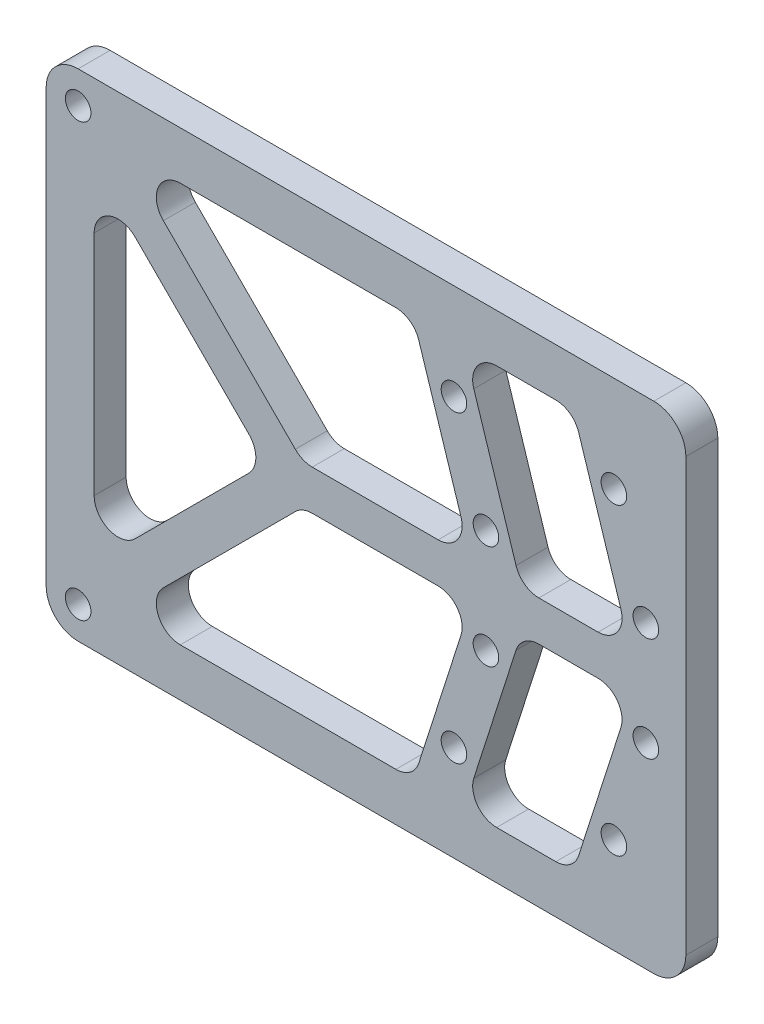
from build123d import *

# Parameters (mm, degrees)
SKETCH_1_W          = 80
SKETCH_1_H          = 62
EXTRUDE_1_DEPTH     = 4
FILLET_1_R          = 4
FILLET_2_R          = 4
SKETCH_2_R          = 1.6
CUT_EXTRUDE_1_DEPTH = 10
SKETCH_3_R          = 1.6
CUT_EXTRUDE_2_DEPTH = 10
CUT_EXTRUDE_3_DEPTH = 10
FILLET_3_R          = 3
CUT_EXTRUDE_4_DEPTH = 10
FILLET_4_R          = 3


with BuildPart() as part:
    # 草图1 → 凸台-拉伸1 (new body)
    with BuildSketch(Plane.XY):
        Rectangle(SKETCH_1_W, SKETCH_1_H)
    extrude(amount=EXTRUDE_1_DEPTH)

    # 圆角1
    fillet_1_edges = [part.edges().sort_by_distance(p)[0] for p in [
        (-40, -31, 2),
        (-40, 31, 2),
    ]]
    fillet(fillet_1_edges, radius=FILLET_1_R)

    # 圆角2
    fillet_2_edges = [part.edges().sort_by_distance(p)[0] for p in [
        (40, -31, 2),
        (40, 31, 2),
    ]]
    fillet(fillet_2_edges, radius=FILLET_2_R)

    # 草图2 → 切除-拉伸1 (cut)
    with BuildSketch(Plane.XY.offset(4)):
        with Locations((11, -19)):
            Circle(SKETCH_2_R)
        with Locations((31, -19)):
            Circle(SKETCH_2_R)
        with Locations((35, 6.5)):
            Circle(SKETCH_2_R)
        with Locations((15, 6.5)):
            Circle(SKETCH_2_R)
        with Locations((11, 19)):
            Circle(SKETCH_2_R)
        with Locations((31, 19)):
            Circle(SKETCH_2_R)
        with Locations(Location((15, -6.5, 0), (0, 0, 180))):
            Circle(SKETCH_2_R)
        with Locations(Location((35, -6.5, 0), (0, 0, 180))):
            Circle(SKETCH_2_R)
    extrude(amount=-CUT_EXTRUDE_1_DEPTH, mode=Mode.SUBTRACT)

    # 草图3 → 切除-拉伸2 (cut)
    with BuildSketch(Plane.XY.offset(4)):
        with Locations((-36, -27)):
            Circle(SKETCH_3_R)
        with Locations((-36, 27)):
            Circle(SKETCH_3_R)
    extrude(amount=-CUT_EXTRUDE_2_DEPTH, mode=Mode.SUBTRACT)

    # 草图4 → 切除-拉伸3 (cut)
    with BuildSketch(Plane.XY.offset(4)):
        Polygon((-12.535533906, 0), (-34, 21.464466094), (-34, -21.464466094), align=None)
        Polygon((5.93014286, 25), (-30.464466094, 25), (-7.964466094, 2.5), (13.13014286, 2.5), align=None)
        Polygon((-7.964466094, -2.5), (-30.464466094, -25), (5.93014286, -25), (13.13014286, -2.5), align=None)
    extrude(amount=-CUT_EXTRUDE_3_DEPTH, mode=Mode.SUBTRACT)

    # 圆角3
    fillet_3_edges = [part.edges().sort_by_distance(p)[0] for p in [
        (-7.964466094, -2.5, 2),
        (13.13014286, -2.5, 2),
        (5.93014286, -25, 2),
        (-30.464466094, -25, 2),
        (-30.464466094, 25, 2),
        (5.93014286, 25, 2),
        (13.13014286, 2.5, 2),
        (-7.964466094, 2.5, 2),
        (-12.535533906, 0, 2),
        (-34, -21.464466094, 2),
        (-34, 21.464466094, 2),
    ]]
    fillet(fillet_3_edges, radius=FILLET_3_R)

    # 草图5 → 切除-拉伸4 (cut)
    with BuildSketch(Plane.XY.offset(4)):
        Polygon((33.13014286, -2.5), (19.42985714, -2.5), (12.22985714, -25), (25.93014286, -25), align=None)
        Polygon((25.93014286, 25), (12.22985714, 25), (19.42985714, 2.5), (33.13014286, 2.5), align=None)
    extrude(amount=-CUT_EXTRUDE_4_DEPTH, mode=Mode.SUBTRACT)

    # 圆角4
    fillet_4_edges = [part.edges().sort_by_distance(p)[0] for p in [
        (19.42985714, -2.5, 2),
        (33.13014286, -2.5, 2),
        (25.93014286, -25, 2),
        (12.22985714, -25, 2),
        (19.42985714, 2.5, 2),
        (12.22985714, 25, 2),
        (25.93014286, 25, 2),
        (33.13014286, 2.5, 2),
    ]]
    fillet(fillet_4_edges, radius=FILLET_4_R)


solid = part.part
